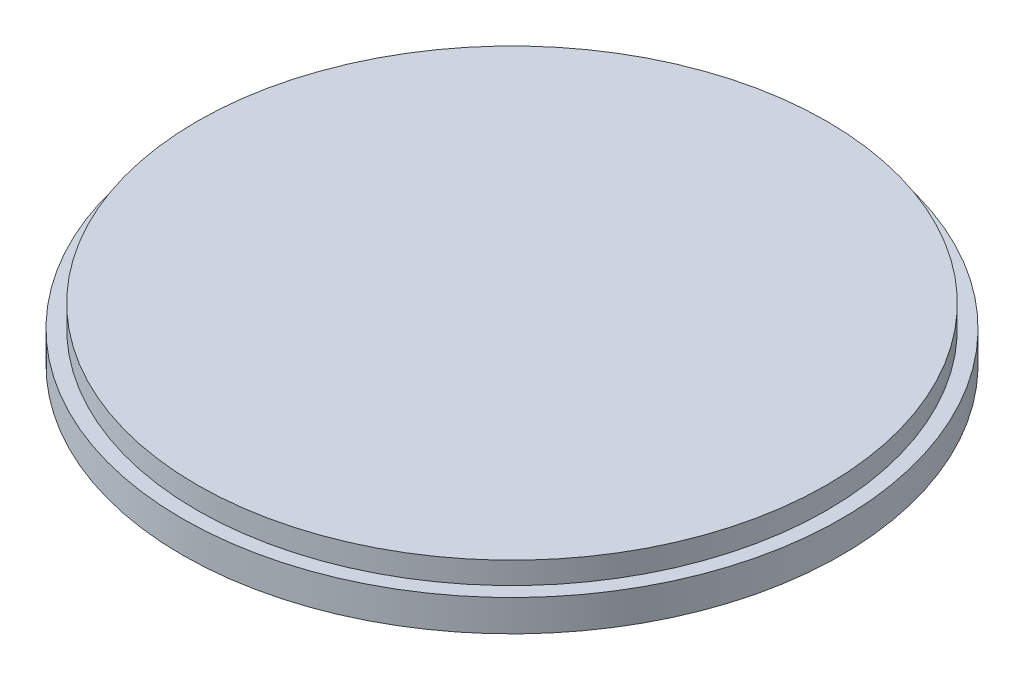
from build123d import *

# Parameters (mm, degrees)
SKETCH2_R                = 43
BOSS_EXTRUDE1_DEPTH      = 3
M3_CLEARANCE_HOLE1_D     = 3.4
M3_CLEARANCE_HOLE1_DEPTH = 4
M3_CLEARANCE_HOLE1_TIP   = 1.021463052


with BuildPart() as part:
    # Sketch1 → Revolve1 (revolve)
    with BuildSketch(Plane.XY, mode=Mode.PRIVATE) as revolve1_sk:
        Polygon((-26.5, -7), (-45, -4.3), (-45, 0), (0, 0), (0, -7), align=None)
    revolve(revolve1_sk.sketch.rotate(Axis((0, -7, 0), (0, 1, 0)), 270), axis=Axis((0, -7, 0), (0, 1, 0)))

    # Sketch2 → Boss-Extrude1 (add)
    with BuildSketch(Plane(origin=(0, 0, 0), x_dir=(1, 0, 0), z_dir=(0, 1, 0))):
        with Locations(Location((0, 0, 0), (0, 0, 270))):
            Circle(SKETCH2_R)
    extrude(amount=BOSS_EXTRUDE1_DEPTH)

    # M3 Clearance Hole1
    with Locations(Plane(origin=(0, -7, 0), x_dir=(-1, 0, 0), z_dir=(0, -1, 0))):
        with Locations((15.556349186, -15.556349186), (15.556349186, 15.556349186), (-15.556349186, 15.556349186), (-15.556349186, -15.556349186)):
            Hole(M3_CLEARANCE_HOLE1_D / 2, depth=M3_CLEARANCE_HOLE1_DEPTH)
            with Locations((0, 0, -(M3_CLEARANCE_HOLE1_DEPTH + M3_CLEARANCE_HOLE1_TIP / 2))):  # 118° drill point
                Cone(0, M3_CLEARANCE_HOLE1_D / 2, M3_CLEARANCE_HOLE1_TIP, mode=Mode.SUBTRACT)


solid = part.part
